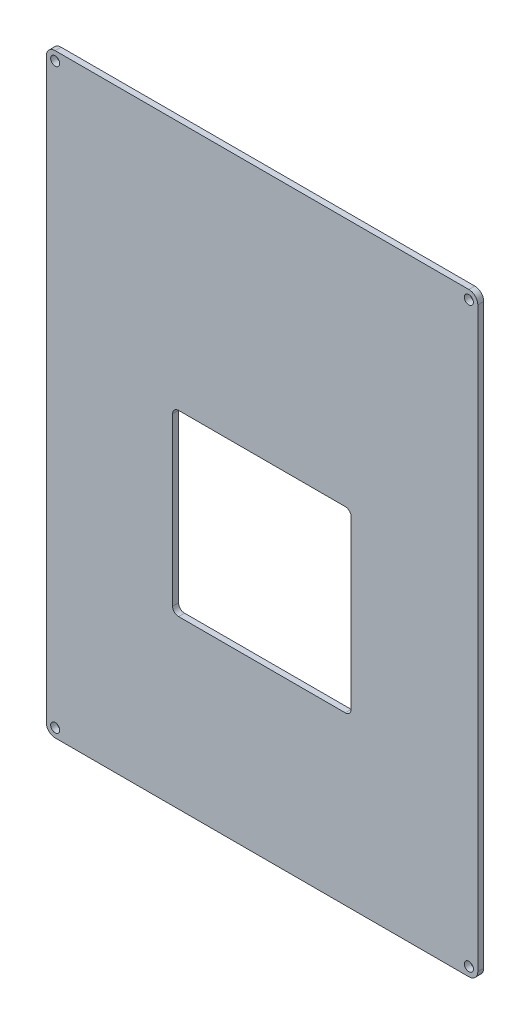
from build123d import *

# Parameters (mm, degrees)
BOSS_EXTRU_1_DEPTH      = 2
ENL_V_MAT_EXTRU_1_DEPTH = 10
ESQUISSE3_R             = 1.52
ENL_V_MAT_EXTRU_2_DEPTH = 10


with BuildPart() as part:
    # Esquisse1 → Boss.-Extru.1 (new body)
    with BuildSketch(Plane.XY):
        with BuildLine():
            Line((-69.5, -97.5), (69.5, -97.5))
            ThreePointArc((69.5, -97.5), (71.621320344, -96.621320344), (72.5, -94.5))
            Line((72.5, -94.5), (72.5, 99.5))
            ThreePointArc((72.5, 99.5), (71.621320344, 101.621320344), (69.5, 102.5))
            Line((69.5, 102.5), (-69.5, 102.5))
            ThreePointArc((-69.5, 102.5), (-71.621320344, 101.621320344), (-72.5, 99.5))
            Line((-72.5, 99.5), (-72.5, -94.5))
            ThreePointArc((-72.5, -94.5), (-71.621320344, -96.621320344), (-69.5, -97.5))
        make_face()
    extrude(amount=BOSS_EXTRU_1_DEPTH)

    # Esquisse2 → Enlèv. mat.-Extru.1 (cut)
    with BuildSketch(Plane(origin=(0, 0, 0), x_dir=(-1, 0, 0), z_dir=(0, 0, -1))):
        with BuildLine():
            Line((-27.945607011, -41.449532586), (28.054392989, -41.449532586))
            ThreePointArc((28.054392989, -41.449532586), (29.468606552, -40.863746148), (30.054392989, -39.449532586))
            Line((30.054392989, -39.449532586), (30.054392989, 16.550467414))
            ThreePointArc((30.054392989, 16.550467414), (29.468606552, 17.964680976), (28.054392989, 18.550467414))
            Line((28.054392989, 18.550467414), (-27.945607011, 18.550467414))
            ThreePointArc((-27.945607011, 18.550467414), (-29.359820573, 17.964680976), (-29.945607011, 16.550467414))
            Line((-29.945607011, 16.550467414), (-29.945607011, -39.449532586))
            ThreePointArc((-29.945607011, -39.449532586), (-29.359820573, -40.863746148), (-27.945607011, -41.449532586))
        make_face()
    extrude(amount=-ENL_V_MAT_EXTRU_1_DEPTH, mode=Mode.SUBTRACT)

    # Esquisse3 → Enlèv. mat.-Extru.2 (cut)
    with BuildSketch(Plane.XY.offset(2)):
        with Locations((69.5, 99.5)):
            Circle(ESQUISSE3_R)
        with Locations((-69.5, 99.5)):
            Circle(ESQUISSE3_R)
        with Locations((-69.5, -94.5)):
            Circle(ESQUISSE3_R)
        with Locations((69.5, -94.5)):
            Circle(ESQUISSE3_R)
    extrude(amount=-ENL_V_MAT_EXTRU_2_DEPTH, mode=Mode.SUBTRACT)


solid = part.part
